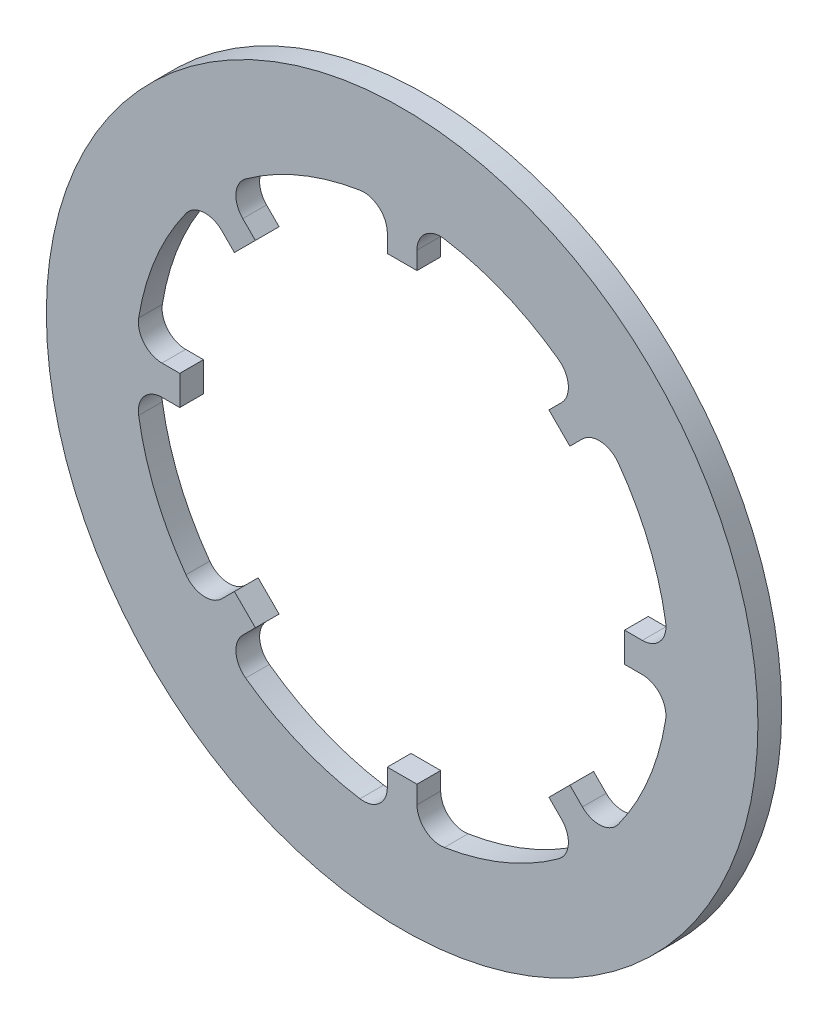
from build123d import *

# Parameters (mm, degrees)
SZKIC1_R                    = 120
SZKIC1_R_2                  = 90
DODANIE_WYCI_GNI_CIE1_DEPTH = 4
DODANIE_WYCI_GNI_CIE2_START = -4
DODANIE_WYCI_GNI_CIE2_DEPTH = 8
SZYK_KO_OWY1_COUNT          = 8


with BuildPart() as part:
    # Szkic1 → Dodanie-wyciągnięcie1 (new, symmetric)
    with BuildSketch(Plane.XY):
        Circle(SZKIC1_R)
        Circle(SZKIC1_R_2, mode=Mode.SUBTRACT)
    extrude(amount=DODANIE_WYCI_GNI_CIE1_DEPTH, both=True)

    # Szkic2 → Dodanie-wyciągnięcie2 (add)
    with BuildSketch(Plane.XY.offset(DODANIE_WYCI_GNI_CIE2_START)):
        with BuildLine():
            Line((5, 75), (-5, 75))
            Line((-5, 75), (-5, 81))
            ThreePointArc((-5, 81), (-7.798428028, 87.063572066), (-14.228153471, 88.868215065))
            ThreePointArc((-14.228153471, 88.868215065), (0, 90), (14.228153471, 88.868215065))
            ThreePointArc((14.228153471, 88.868215065), (7.798428028, 87.063572066), (5, 81))
            Line((5, 81), (5, 75))
        make_face()
    dodanie_wyci_gni_cie2 = extrude(amount=DODANIE_WYCI_GNI_CIE2_DEPTH)

    # Szyk kołowy1: Dodanie-wyciągnięcie2 ×8 about axis
    szyk_ko_owy1_axis = Axis((0, 0, 0), (0, 0, 1))
    for i in range(1, SZYK_KO_OWY1_COUNT):
        add(dodanie_wyci_gni_cie2.rotate(szyk_ko_owy1_axis, i * 360 / SZYK_KO_OWY1_COUNT))


solid = part.part
